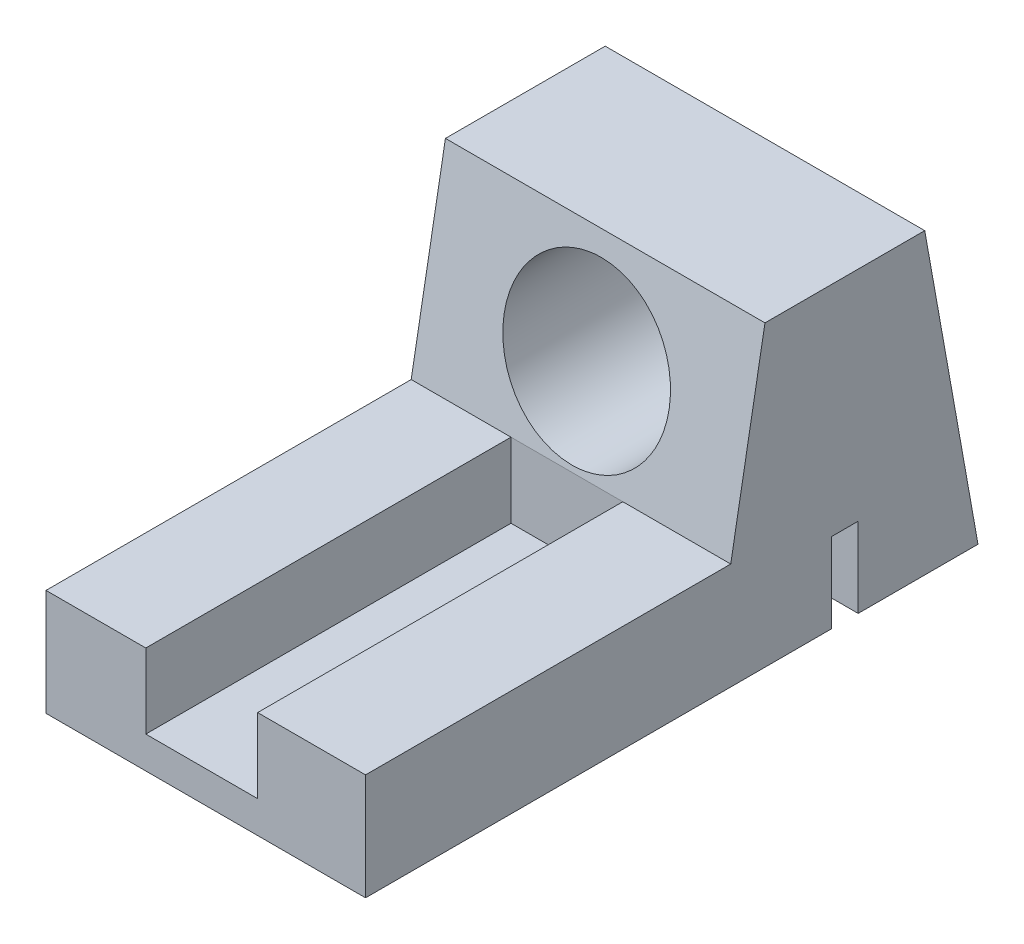
from build123d import *

# Parameters (mm, degrees)
EXTRUDE_1_DEPTH          = 60
CUT_EXTRUDE_1_DEPTH      = 40
CUT_EXTRUDE_1_DEPTH_BACK = 29
SKETCH_4_R               = 15.5
SKETCH_5_W               = 5
SKETCH_5_H               = 30
CUT_EXTRUDE_2_DEPTH      = 83.900874001
SKETCH_7_W               = 60
SKETCH_7_H               = 85.424918669
EXTRUDE_2_DEPTH          = 20
CUT_EXTRUDE_START        = -31.454396
SKETCH_8_W               = 21
SKETCH_8_H               = 68.571428571
CUT_EXTRUDE_3_DEPTH      = 14


with BuildPart() as part:
    # 스케치3 → 보스-돌출1 (new body)
    with BuildSketch(Plane(origin=(0, 0, 0), x_dir=(0, 0, -1), z_dir=(1, 0, 0))):
        Polygon((-25, -51.454396413), (25, -51.454396413), (15, 4.545603587), (-15, 4.545603587), align=None)
    extrude(amount=EXTRUDE_1_DEPTH)

    # 스케치4 → 컷-돌출1 (cut, two sides: drawn at the far end of the back side and taken through both)
    with BuildSketch(Plane.XY.offset(-CUT_EXTRUDE_1_DEPTH_BACK)):
        with Locations(Location((30, -14.954396413, 0), (0, 0, 90))):
            Circle(SKETCH_4_R)
    extrude(amount=CUT_EXTRUDE_1_DEPTH + CUT_EXTRUDE_1_DEPTH_BACK, mode=Mode.SUBTRACT)

    # 스케치5 → 컷-돌출2 (cut, through all)
    with BuildSketch(Plane(origin=(0, 0, 0), x_dir=(0, 0, -1), z_dir=(1, 0, 0))):
        with Locations((0, -51.454396413)):
            Rectangle(SKETCH_5_W, SKETCH_5_H)
    extrude(amount=CUT_EXTRUDE_2_DEPTH, mode=Mode.SUBTRACT)

    # 스케치7 → 보스-돌출2 (add)
    with BuildSketch(Plane(origin=(0, -51.454396413, 0), x_dir=(-1, 0, 0), z_dir=(0, -1, 0))):
        with Locations((-30, -47.287540666)):
            Rectangle(SKETCH_7_W, SKETCH_7_H)
    extrude(amount=-EXTRUDE_2_DEPTH)

    # 스케치8 → 컷-돌출3 (cut)
    with BuildSketch(Plane(origin=(0, 0, 0), x_dir=(1, 0, 0), z_dir=(0, 1, 0)).offset(CUT_EXTRUDE_START)):
        with Locations((29.238428934, -55.714285715)):
            Rectangle(SKETCH_8_W, SKETCH_8_H)
    extrude(amount=-CUT_EXTRUDE_3_DEPTH, mode=Mode.SUBTRACT)


solid = part.part
